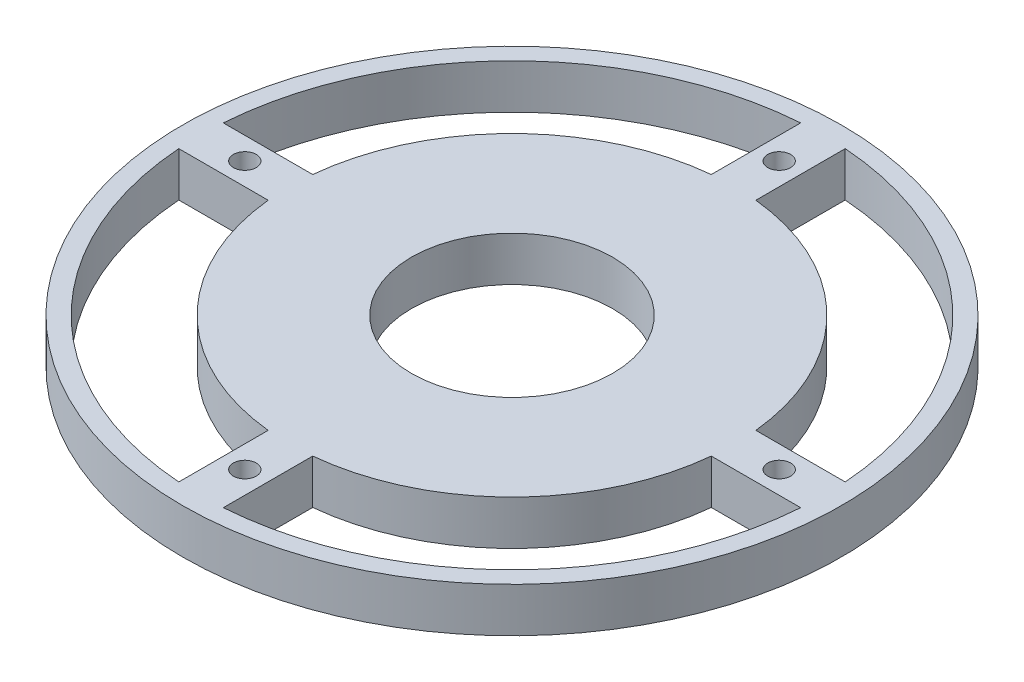
from build123d import *

# Parameters (mm, degrees)
SKETCH1_R           = 46.99
BOSS_EXTRUDE1_DEPTH = 6.35
SKETCH2_R           = 14.351
CUT_EXTRUDE1_DEPTH  = 6.35
CUT_EXTRUDE2_DEPTH  = 6.35
CIRPATTERN1_COUNT   = 4


with BuildPart() as part:
    # Sketch1 → Boss-Extrude1 (new body)
    with BuildSketch(Plane(origin=(0, 0, 0), x_dir=(1, 0, 0), z_dir=(0, 1, 0))):
        Circle(SKETCH1_R)
    extrude(amount=BOSS_EXTRUDE1_DEPTH)

    # Sketch2 → Cut-Extrude1 (cut)
    with BuildSketch(Plane(origin=(0, 6.35, 0), x_dir=(1, 0, 0), z_dir=(0, 1, 0))):
        Circle(SKETCH2_R)
    extrude(amount=-CUT_EXTRUDE1_DEPTH, mode=Mode.SUBTRACT)

    # Sketch3 → Cut-Extrude2 (cut)
    with BuildSketch(Plane(origin=(0, 6.35, 0), x_dir=(1, 0, 0), z_dir=(0, 1, 0))):
        with BuildLine():
            Line((-3.175, 31.590851128), (-3.175, 44.336462139))
            ThreePointArc((-3.175, 44.336462139), (-31.430896424, 31.430896424), (-44.336462139, 3.175))
            Line((-44.336462139, 3.175), (-31.590851128, 3.175))
            ThreePointArc((-31.590851128, 3.175), (-22.450640303, 22.450640303), (-3.175, 31.590851128))
        make_face()
        with BuildLine():
            ThreePointArc((44.336462139, 3.175), (31.430896424, 31.430896424), (3.175, 44.336462139))
            Line((3.175, 44.336462139), (3.175, 31.590851128))
            ThreePointArc((3.175, 31.590851128), (22.450640303, 22.450640303), (31.590851128, 3.175))
            Line((31.590851128, 3.175), (44.336462139, 3.175))
        make_face()
        with BuildLine():
            Line((-31.590851128, -3.175), (-44.336462139, -3.175))
            ThreePointArc((-44.336462139, -3.175), (-31.430896424, -31.430896424), (-3.175, -44.336462139))
            Line((-3.175, -44.336462139), (-3.175, -31.590851128))
            ThreePointArc((-3.175, -31.590851128), (-22.450640303, -22.450640303), (-31.590851128, -3.175))
        make_face()
        with BuildLine():
            ThreePointArc((3.175, -44.336462139), (31.430896424, -31.430896424), (44.336462139, -3.175))
            Line((44.336462139, -3.175), (31.590851128, -3.175))
            ThreePointArc((31.590851128, -3.175), (22.450640303, -22.450640303), (3.175, -31.590851128))
            Line((3.175, -31.590851128), (3.175, -44.336462139))
        make_face()
    extrude(amount=-CUT_EXTRUDE2_DEPTH, mode=Mode.SUBTRACT)

    # Sketch4 → #4 Clearance Hole1 (revolve, cut)
    with BuildSketch(Plane(origin=(0, 6.35, -38.1), x_dir=(0, 0, 1), z_dir=(1, 0, 0))):
        Polygon((0, 0), (0, 11.140574487), (1.63195, 10.16), (1.63195, 0), align=None)
    f_4_clearance_hole1 = revolve(axis=Axis((0, 12.7, -38.1), (0, -1, 0)), mode=Mode.SUBTRACT)

    # CirPattern1: #4 Clearance Hole1 ×4 about axis
    cirpattern1_axis = Axis((0, 6.35, 0), (0, 1, 0))
    for i in range(1, CIRPATTERN1_COUNT):
        add(f_4_clearance_hole1.rotate(cirpattern1_axis, i * 360 / CIRPATTERN1_COUNT), mode=Mode.SUBTRACT)


solid = part.part
